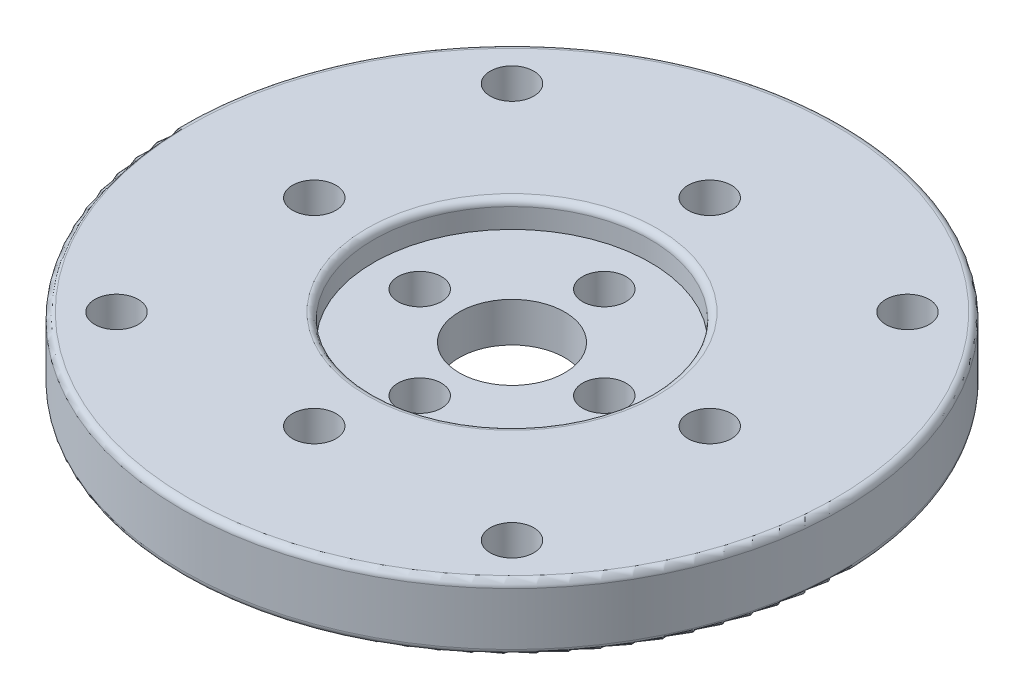
from build123d import *

# Parameters (mm, degrees)
SKETCH1_R           = 25
SKETCH1_R_2         = 4
BOSS_EXTRUDE1_DEPTH = 2.5
SKETCH4_R           = 10.5
CUT_EXTRUDE3_DEPTH  = 2
CUT_EXTRUDE2_REACH  = 37.707
SKETCH3_R           = 1.65
FILLET1_R           = 0.5
CUT_EXTRUDE4_REACH  = 37.482
SKETCH5_R           = 1.65


with BuildPart() as part:
    # Sketch1 → Boss-Extrude1 (new, symmetric)
    with BuildSketch(Plane(origin=(0, 0, 0), x_dir=(1, 0, 0), z_dir=(0, 1, 0))):
        with Locations(Location((0, 0, 0), (0, 0, 270))):
            Circle(SKETCH1_R)
        with Locations(Location((0, 0, 0), (0, 0, 270))):
            Circle(SKETCH1_R_2, mode=Mode.SUBTRACT)
    extrude(amount=BOSS_EXTRUDE1_DEPTH, both=True)

    # Sketch4 → Cut-Extrude3 (cut)
    with BuildSketch(Plane(origin=(0, 2.5, 0), x_dir=(1, 0, 0), z_dir=(0, 1, 0))):
        with Locations(Location((0, 0, 0), (0, 0, 270))):
            Circle(SKETCH4_R)
    extrude(amount=-CUT_EXTRUDE3_DEPTH, mode=Mode.SUBTRACT)

    # Sketch3 → Cut-Extrude2 (cut, up to next)
    with BuildSketch(Plane.XZ.offset(2.5), mode=Mode.PRIVATE) as cut_extrude2_sk1:
        with Locations(Location((-15, 15, 0), (0, 0, 270))):
            Circle(SKETCH3_R)
    cut_extrude2_tool1 = extrude(cut_extrude2_sk1.sketch, amount=-CUT_EXTRUDE2_REACH, mode=Mode.PRIVATE) & part.part
    # Sketch3 → Cut-Extrude2 (cut, up to next)
    with BuildSketch(Plane.XZ.offset(2.5), mode=Mode.PRIVATE) as cut_extrude2_sk2:
        with Locations(Location((15, 15, 0), (0, 0, 270))):
            Circle(SKETCH3_R)
    cut_extrude2_tool2 = extrude(cut_extrude2_sk2.sketch, amount=-CUT_EXTRUDE2_REACH, mode=Mode.PRIVATE) & part.part
    # Sketch3 → Cut-Extrude2 (cut, up to next)
    with BuildSketch(Plane.XZ.offset(2.5), mode=Mode.PRIVATE) as cut_extrude2_sk3:
        with Locations(Location((15, -15, 0), (0, 0, 270))):
            Circle(SKETCH3_R)
    cut_extrude2_tool3 = extrude(cut_extrude2_sk3.sketch, amount=-CUT_EXTRUDE2_REACH, mode=Mode.PRIVATE) & part.part
    # Sketch3 → Cut-Extrude2 (cut, up to next)
    with BuildSketch(Plane.XZ.offset(2.5), mode=Mode.PRIVATE) as cut_extrude2_sk4:
        with Locations(Location((-15, -15, 0), (0, 0, 270))):
            Circle(SKETCH3_R)
    cut_extrude2_tool4 = extrude(cut_extrude2_sk4.sketch, amount=-CUT_EXTRUDE2_REACH, mode=Mode.PRIVATE) & part.part
    # Sketch3 → Cut-Extrude2 (cut, up to next)
    with BuildSketch(Plane.XZ.offset(2.5), mode=Mode.PRIVATE) as cut_extrude2_sk5:
        with Locations(Location((0, 15, 0), (0, 0, 270))):
            Circle(SKETCH3_R)
    cut_extrude2_tool5 = extrude(cut_extrude2_sk5.sketch, amount=-CUT_EXTRUDE2_REACH, mode=Mode.PRIVATE) & part.part
    # Sketch3 → Cut-Extrude2 (cut, up to next)
    with BuildSketch(Plane.XZ.offset(2.5), mode=Mode.PRIVATE) as cut_extrude2_sk6:
        with Locations(Location((15, 0, 0), (0, 0, 270))):
            Circle(SKETCH3_R)
    cut_extrude2_tool6 = extrude(cut_extrude2_sk6.sketch, amount=-CUT_EXTRUDE2_REACH, mode=Mode.PRIVATE) & part.part
    # Sketch3 → Cut-Extrude2 (cut, up to next)
    with BuildSketch(Plane.XZ.offset(2.5), mode=Mode.PRIVATE) as cut_extrude2_sk7:
        with Locations(Location((0, -15, 0), (0, 0, 270))):
            Circle(SKETCH3_R)
    cut_extrude2_tool7 = extrude(cut_extrude2_sk7.sketch, amount=-CUT_EXTRUDE2_REACH, mode=Mode.PRIVATE) & part.part
    # Sketch3 → Cut-Extrude2 (cut, up to next)
    with BuildSketch(Plane.XZ.offset(2.5), mode=Mode.PRIVATE) as cut_extrude2_sk8:
        with Locations(Location((-15, 0, 0), (0, 0, 270))):
            Circle(SKETCH3_R)
    cut_extrude2_tool8 = extrude(cut_extrude2_sk8.sketch, amount=-CUT_EXTRUDE2_REACH, mode=Mode.PRIVATE) & part.part
    add(cut_extrude2_tool1.solids().sort_by_distance((-15, -2.5, 15))[0], mode=Mode.SUBTRACT)
    add(cut_extrude2_tool2.solids().sort_by_distance((15, -2.5, 15))[0], mode=Mode.SUBTRACT)
    add(cut_extrude2_tool3.solids().sort_by_distance((15, -2.5, -15))[0], mode=Mode.SUBTRACT)
    add(cut_extrude2_tool4.solids().sort_by_distance((-15, -2.5, -15))[0], mode=Mode.SUBTRACT)
    add(cut_extrude2_tool5.solids().sort_by_distance((0, -2.5, 15))[0], mode=Mode.SUBTRACT)
    add(cut_extrude2_tool6.solids().sort_by_distance((15, -2.5, 0))[0], mode=Mode.SUBTRACT)
    add(cut_extrude2_tool7.solids().sort_by_distance((0, -2.5, -15))[0], mode=Mode.SUBTRACT)
    add(cut_extrude2_tool8.solids().sort_by_distance((-15, -2.5, 0))[0], mode=Mode.SUBTRACT)

    # Fillet1
    fillet1_edges = [part.edges().sort_by_distance(p)[0] for p in [
        (0, 2.5, -10.5),
        (0, -2.5, -25),
        (0, 2.5, -25),
    ]]
    fillet(fillet1_edges, radius=FILLET1_R)

    # Sketch5 → Cut-Extrude4 (cut, up to next)
    with BuildSketch(Plane(origin=(0, 0.5, 0), x_dir=(1, 0, 0), z_dir=(0, 1, 0)), mode=Mode.PRIVATE) as cut_extrude4_sk1:
        with Locations(Location((0, 7, 0), (0, 0, 270))):
            Circle(SKETCH5_R)
    cut_extrude4_tool1 = extrude(cut_extrude4_sk1.sketch, amount=-CUT_EXTRUDE4_REACH, mode=Mode.PRIVATE) & part.part
    # Sketch5 → Cut-Extrude4 (cut, up to next)
    with BuildSketch(Plane(origin=(0, 0.5, 0), x_dir=(1, 0, 0), z_dir=(0, 1, 0)), mode=Mode.PRIVATE) as cut_extrude4_sk2:
        with Locations(Location((0, -7, 0), (0, 0, 270))):
            Circle(SKETCH5_R)
    cut_extrude4_tool2 = extrude(cut_extrude4_sk2.sketch, amount=-CUT_EXTRUDE4_REACH, mode=Mode.PRIVATE) & part.part
    # Sketch5 → Cut-Extrude4 (cut, up to next)
    with BuildSketch(Plane(origin=(0, 0.5, 0), x_dir=(1, 0, 0), z_dir=(0, 1, 0)), mode=Mode.PRIVATE) as cut_extrude4_sk3:
        with Locations(Location((7, 0, 0), (0, 0, 270))):
            Circle(SKETCH5_R)
    cut_extrude4_tool3 = extrude(cut_extrude4_sk3.sketch, amount=-CUT_EXTRUDE4_REACH, mode=Mode.PRIVATE) & part.part
    # Sketch5 → Cut-Extrude4 (cut, up to next)
    with BuildSketch(Plane(origin=(0, 0.5, 0), x_dir=(1, 0, 0), z_dir=(0, 1, 0)), mode=Mode.PRIVATE) as cut_extrude4_sk4:
        with Locations(Location((-7, 0, 0), (0, 0, 270))):
            Circle(SKETCH5_R)
    cut_extrude4_tool4 = extrude(cut_extrude4_sk4.sketch, amount=-CUT_EXTRUDE4_REACH, mode=Mode.PRIVATE) & part.part
    add(cut_extrude4_tool1.solids().sort_by_distance((0, 0.5, -7))[0], mode=Mode.SUBTRACT)
    add(cut_extrude4_tool2.solids().sort_by_distance((0, 0.5, 7))[0], mode=Mode.SUBTRACT)
    add(cut_extrude4_tool3.solids().sort_by_distance((7, 0.5, 0))[0], mode=Mode.SUBTRACT)
    add(cut_extrude4_tool4.solids().sort_by_distance((-7, 0.5, 0))[0], mode=Mode.SUBTRACT)


solid = part.part
